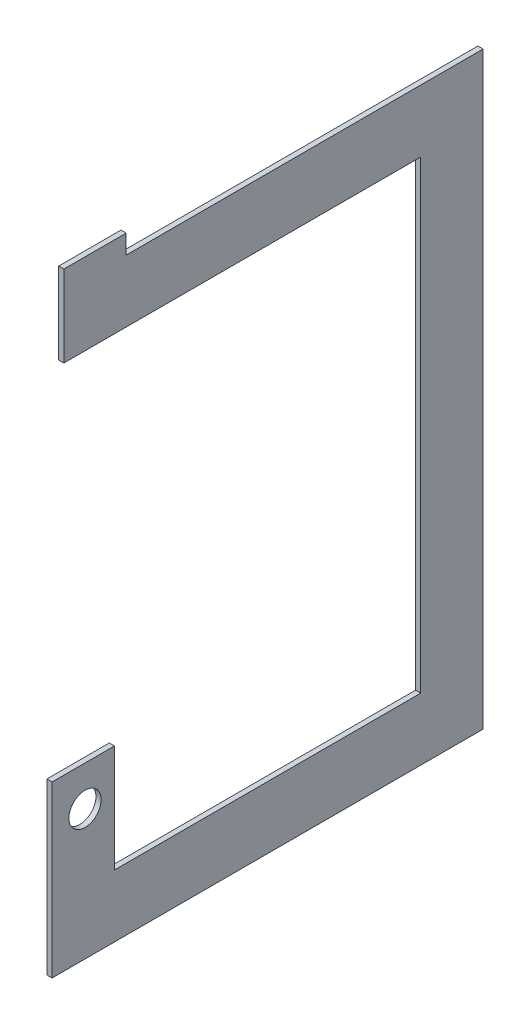
from build123d import *

# Parameters (mm, degrees)
SKETCH2_R           = 0.93
BOSS_EXTRUDE1_DEPTH = 0.3


with BuildPart() as part:
    # Sketch2 → Boss-Extrude1 (new body)
    with BuildSketch(Plane(origin=(0, 0, 0), x_dir=(0, 0, -1), z_dir=(1, 0, 0))):
        Polygon((0, 0), (0, -9.8), (24.8771, -9.8), (24.8771, 24.2), (4.2771, 24.2), (4.2771, 25.3), (0.6771, 25.3), (0.6771, 20.6), (21.2771, 20.6), (21.2771, -6.2), (3.6, -6.2), (3.6, 0), align=None)
        with Locations((1.9, -2.295)):
            Circle(SKETCH2_R, mode=Mode.SUBTRACT)
    extrude(amount=BOSS_EXTRUDE1_DEPTH)


solid = part.part
